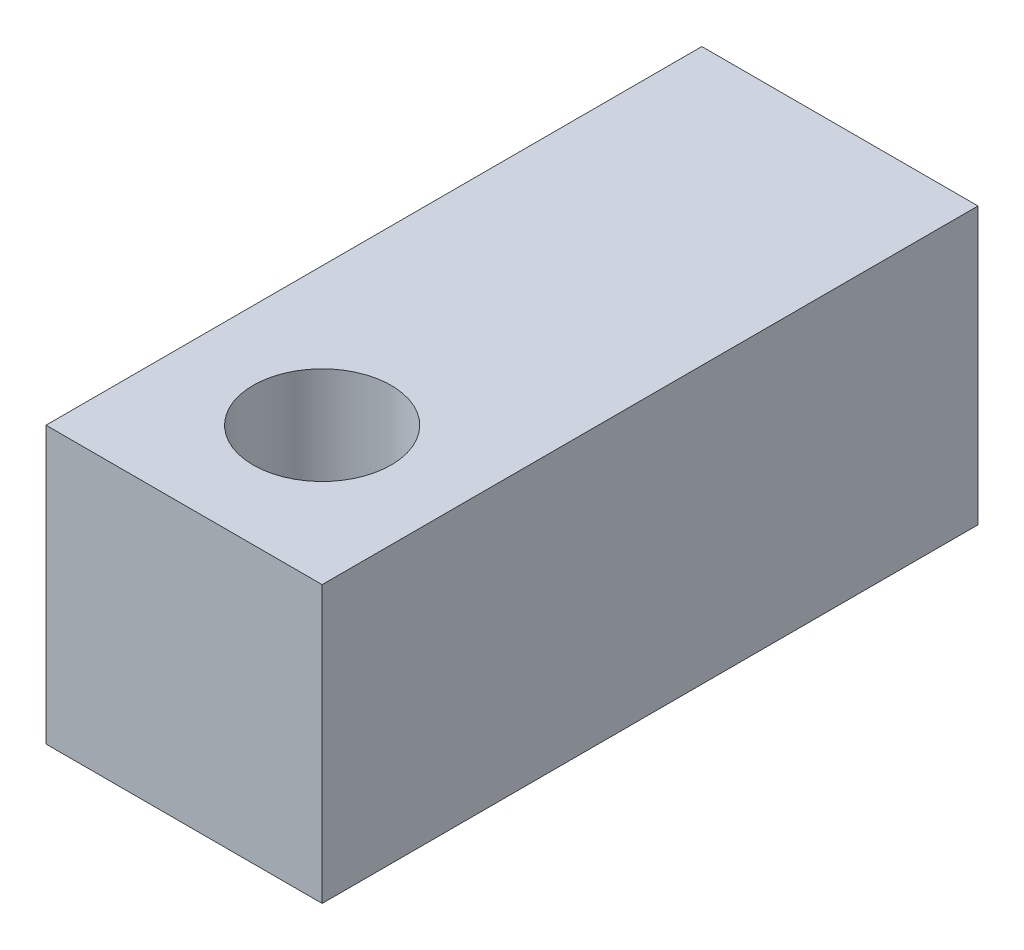
from build123d import *

# Parameters (mm, degrees)
SKETCH1_W                             = 16
SKETCH1_H                             = 16
SHAFT_SUPPORT_DEPTH                   = 38
D8_GUIDE_SHAFT_SEAT_DEPTH             = 40.648455203
D8_GUIDE_SHAFT_SEAT_DEPTH_BACK        = 40.648455203
SKETCH2_R                             = 4
SKETCH3_R                             = 2.5
M5_BOTTOM_THREAD_MAJOR_ENVELOPE_DEPTH = 8


with BuildPart() as part:
    # Sketch1 → Shaft_Support (new body)
    with BuildSketch(Plane.XY):
        Rectangle(SKETCH1_W, SKETCH1_H)
    extrude(amount=SHAFT_SUPPORT_DEPTH)

    # Sketch2 → D8_Guide_Shaft_Seat (cut, two sides: drawn at the far end of the back side and taken through both)
    with BuildSketch(Plane(origin=(0, 0, 0), x_dir=(1, 0, 0), z_dir=(0, 1, 0)).offset(-D8_GUIDE_SHAFT_SEAT_DEPTH_BACK)):
        with Locations(Location((0, -30, 0), (0, 0, 270))):
            Circle(SKETCH2_R)
    extrude(amount=D8_GUIDE_SHAFT_SEAT_DEPTH + D8_GUIDE_SHAFT_SEAT_DEPTH_BACK, mode=Mode.SUBTRACT)

    # Sketch3 → M5_Bottom_Thread_Major_Envelope (cut)
    with BuildSketch(Plane(origin=(0, 0, 0), x_dir=(-1, 0, 0), z_dir=(0, 0, -1))):
        Circle(SKETCH3_R)
    extrude(amount=-M5_BOTTOM_THREAD_MAJOR_ENVELOPE_DEPTH, mode=Mode.SUBTRACT)


solid = part.part
